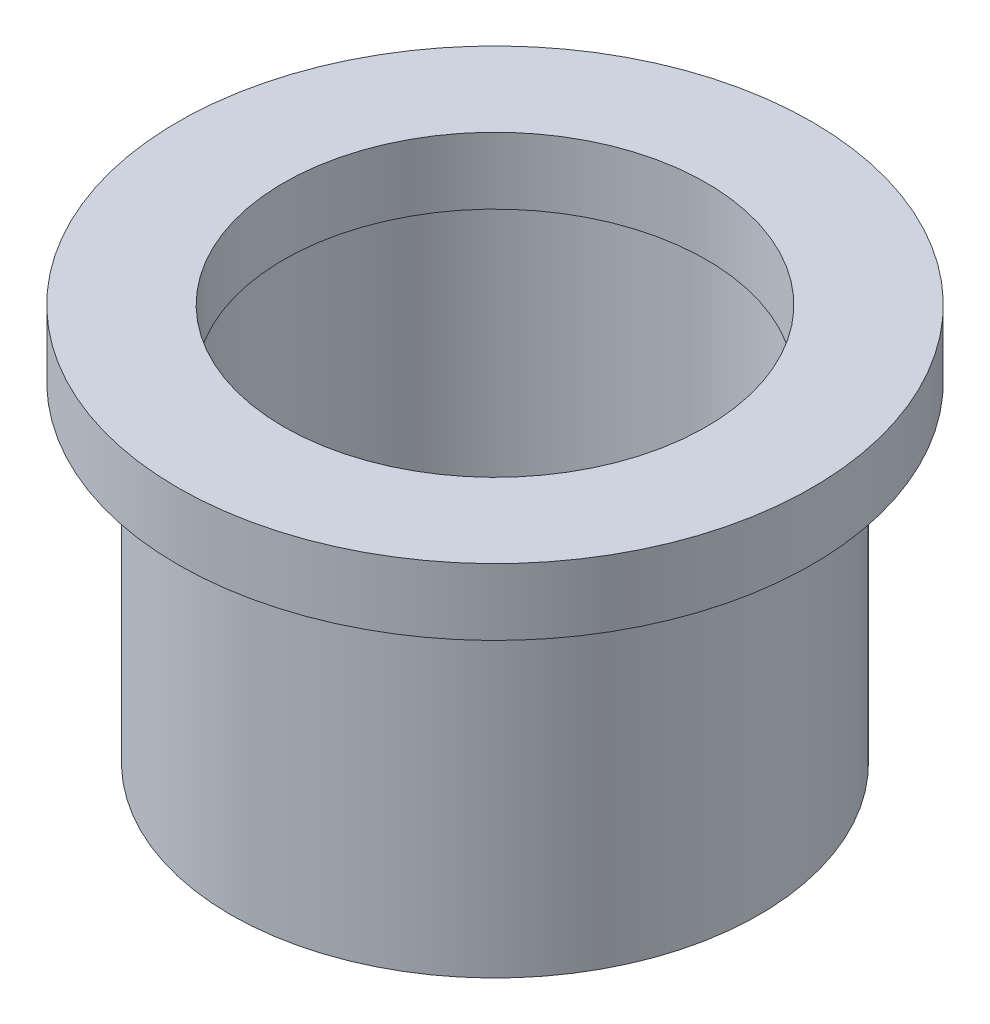
from build123d import *


with BuildPart() as part:
    # Sketch1 → Revolve1 (revolve)
    with BuildSketch(Plane.XY, mode=Mode.PRIVATE) as revolve1_sk:
        Polygon((3.175, -3.143907579), (3.175, -4.143907579), (3.21875, -4.143907579), (3.21875, -9.097032579), (3.96875, -9.097032579), (3.96875, -4.143907579), (4.7625, -4.143907579), (4.7625, -3.143907579), align=None)
    revolve(revolve1_sk.sketch.rotate(Axis((0, 0, 0), (0, -1, 0)), 90), axis=Axis((0, 0, 0), (0, -1, 0)))


solid = part.part
